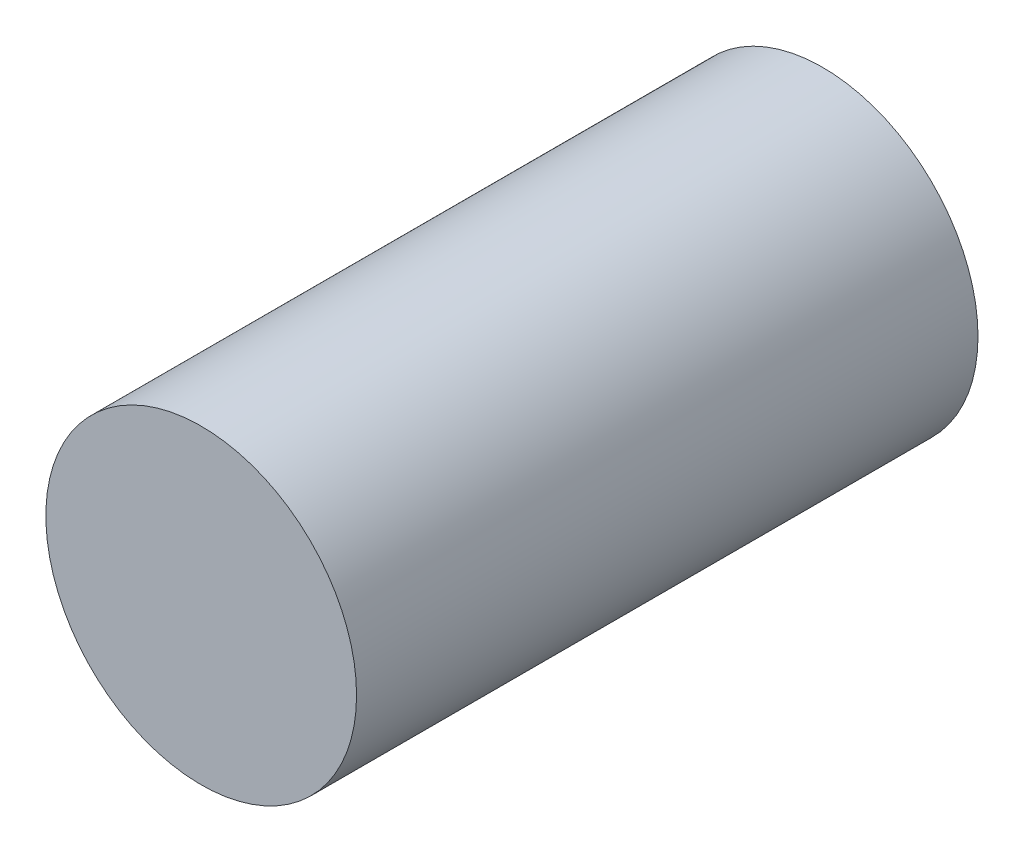
from build123d import *

# Parameters (mm, degrees)
SKETCH1_R           = 50
BOSS_EXTRUDE1_DEPTH = 200


with BuildPart() as part:
    # Sketch1 → Boss-Extrude1 (new body)
    with BuildSketch(Plane.XY):
        Circle(SKETCH1_R)
    extrude(amount=BOSS_EXTRUDE1_DEPTH)


solid = part.part
